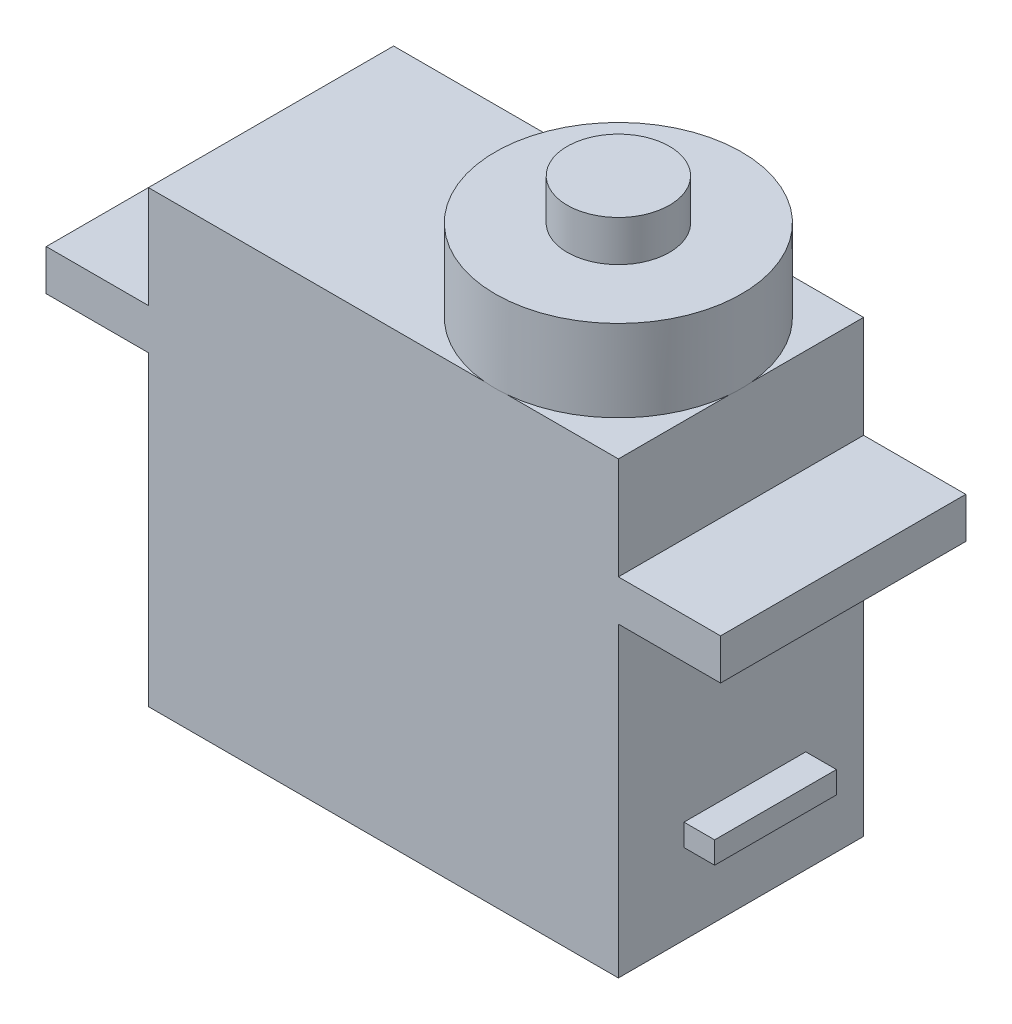
from build123d import *

# Parameters (mm, degrees)
SKETCH_1_W      = 23
SKETCH_1_H      = 12
EXTRUDE_1_DEPTH = 22
SKETCH_2_W      = 12
SKETCH_2_H      = 2
EXTRUDE_2_DEPTH = 5
SKETCH_3_W      = 5.960545255
SKETCH_3_H      = 1.076312346
EXTRUDE_3_DEPTH = 1.5
SKETCH_4_W      = 12
SKETCH_4_H      = 2
EXTRUDE_4_DEPTH = 5
SKETCH_5_R      = 6.025
EXTRUDE_5_DEPTH = 4
SKETCH_6_R      = 2.5
EXTRUDE_6_DEPTH = 2


with BuildPart() as part:
    # 草图1 → 凸台-拉伸1 (new body)
    with BuildSketch(Plane(origin=(0, 0, 0), x_dir=(1, 0, 0), z_dir=(0, 1, 0))):
        with Locations((11.5, 6)):
            Rectangle(SKETCH_1_W, SKETCH_1_H)
    extrude(amount=EXTRUDE_1_DEPTH)

    # 草图2 → 凸台-拉伸2 (add)
    with BuildSketch(Plane(origin=(23, 0, 0), x_dir=(0, 0, -1), z_dir=(1, 0, 0))):
        with Locations((6, 16)):
            Rectangle(SKETCH_2_W, SKETCH_2_H)
    extrude(amount=EXTRUDE_2_DEPTH)

    # 草图3 → 凸台-拉伸3 (add)
    with BuildSketch(Plane(origin=(23, 0, 0), x_dir=(0, 0, -1), z_dir=(1, 0, 0))):
        with Locations((6.190854898, 4.461843827)):
            Rectangle(SKETCH_3_W, SKETCH_3_H)
    extrude(amount=EXTRUDE_3_DEPTH)

    # 草图4 → 凸台-拉伸4 (add)
    with BuildSketch(Plane.ZY):
        with Locations((-6, 16)):
            Rectangle(SKETCH_4_W, SKETCH_4_H)
    extrude(amount=EXTRUDE_4_DEPTH)

    # 草图5 → 凸台-拉伸5 (add)
    with BuildSketch(Plane(origin=(0, 22, 0), x_dir=(1, 0, 0), z_dir=(0, 1, 0))):
        with Locations(Location((17, 6, 0), (0, 0, 84.778691018))):
            Circle(SKETCH_5_R)
    extrude(amount=EXTRUDE_5_DEPTH)

    # 草图6 → 凸台-拉伸6 (add)
    with BuildSketch(Plane(origin=(0, 26, 0), x_dir=(1, 0, 0), z_dir=(0, 1, 0))):
        with Locations(Location((17, 6, 0), (0, 0, 270))):
            Circle(SKETCH_6_R)
    extrude(amount=EXTRUDE_6_DEPTH)


solid = part.part
